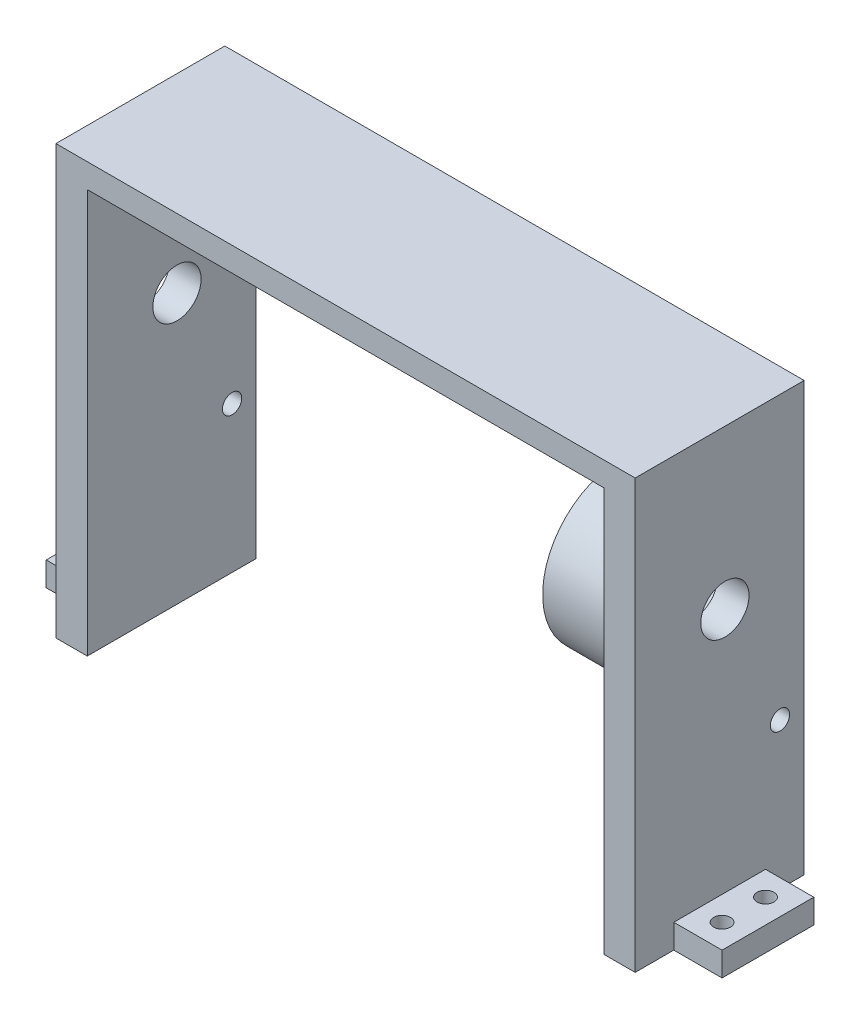
from build123d import *

# Parameters (mm, degrees)
ESQUISSE4_R             = 2
ESQUISSE4_R_2           = 5
BOSS_EXTRU_1_DEPTH      = 120
ESQUISSE19_W            = 107
ESQUISSE19_H            = 83.7
ENL_V_MAT_EXTRU_1_DEPTH = 120
ESQUISSE20_R            = 16.25
ESQUISSE20_R_2          = 14
BOSS_EXTRU_2_DEPTH      = 21.5
ESQUISSE28_W            = 19
ESQUISSE28_H            = 5
BOSS_EXTRU_6_DEPTH      = 10
ESQUISSE29_R            = 1.75
ENL_V_MAT_EXTRU_6_DEPTH = 10
ESQUISSE33_W            = 19
ESQUISSE33_H            = 5
BOSS_EXTRU_7_DEPTH      = 10
ESQUISSE34_R            = 1.975077454
ESQUISSE34_R_2          = 2.125479737
ENL_V_MAT_EXTRU_7_DEPTH = 159.52662237


with BuildPart() as part:
    # Esquisse4 → Boss.-Extru.1 (new body)
    with BuildSketch(Plane(origin=(0, 0, 0), x_dir=(0, 0, -1), z_dir=(1, 0, 0))):
        Polygon((30, -37.604112468), (35, -37.604112468), (35, 51.095887532), (0, 51.095887532), (0, -37.604112468), align=None)
        with Locations((30, -7.314112468)):
            Circle(ESQUISSE4_R, mode=Mode.SUBTRACT)
        with Locations((18.58577647, 18.253748241)):
            Circle(ESQUISSE4_R_2, mode=Mode.SUBTRACT)
    extrude(amount=BOSS_EXTRU_1_DEPTH)

    # Esquisse19 → Enlèv. mat.-Extru.1 (cut)
    with BuildSketch(Plane(origin=(0, 0, -35), x_dir=(-1, 0, 0), z_dir=(0, 0, -1))):
        with Locations((-60, 4.245887532)):
            Rectangle(ESQUISSE19_W, ESQUISSE19_H)
    extrude(amount=-ENL_V_MAT_EXTRU_1_DEPTH, mode=Mode.SUBTRACT)

    # Esquisse20 → Boss.-Extru.2 (add)
    with BuildSketch(Plane(origin=(120, 0, 0), x_dir=(0, 0, -1), z_dir=(1, 0, 0))):
        with Locations((18.58577647, 18.253748241)):
            Circle(ESQUISSE20_R)
        with Locations((18.58577647, 18.253748241)):
            Circle(ESQUISSE20_R_2, mode=Mode.SUBTRACT)
    extrude(amount=-BOSS_EXTRU_2_DEPTH)

    # Esquisse28 → Boss.-Extru.6 (add)
    with BuildSketch(Plane(origin=(120, 0, 0), x_dir=(0, 0, -1), z_dir=(1, 0, 0))):
        with Locations((17.5, -35.104112468)):
            Rectangle(ESQUISSE28_W, ESQUISSE28_H)
    extrude(amount=BOSS_EXTRU_6_DEPTH)

    # Esquisse29 → Enlèv. mat.-Extru.6 (cut)
    with BuildSketch(Plane(origin=(0, -32.604112468, 0), x_dir=(1, 0, 0), z_dir=(0, 1, 0))):
        with Locations(Location((125, 22, 0), (0, 0, 270))):
            Circle(ESQUISSE29_R)
        with Locations(Location((125, 13, 0), (0, 0, 270))):
            Circle(ESQUISSE29_R)
    extrude(amount=-ENL_V_MAT_EXTRU_6_DEPTH, mode=Mode.SUBTRACT)

    # Esquisse33 → Boss.-Extru.7 (add)
    with BuildSketch(Plane.ZY):
        with Locations((-17.5, -35.104112468)):
            Rectangle(ESQUISSE33_W, ESQUISSE33_H)
    extrude(amount=BOSS_EXTRU_7_DEPTH)

    # Esquisse34 → Enlèv. mat.-Extru.7 (cut, through all)
    with BuildSketch(Plane(origin=(0, -32.604112468, 0), x_dir=(1, 0, 0), z_dir=(0, 1, 0))):
        with Locations(Location((-5, 22, 0), (0, 0, 270))):
            Circle(ESQUISSE34_R)
        with Locations(Location((-5, 13, 0), (0, 0, 270))):
            Circle(ESQUISSE34_R_2)
    extrude(amount=-ENL_V_MAT_EXTRU_7_DEPTH, mode=Mode.SUBTRACT)


solid = part.part
